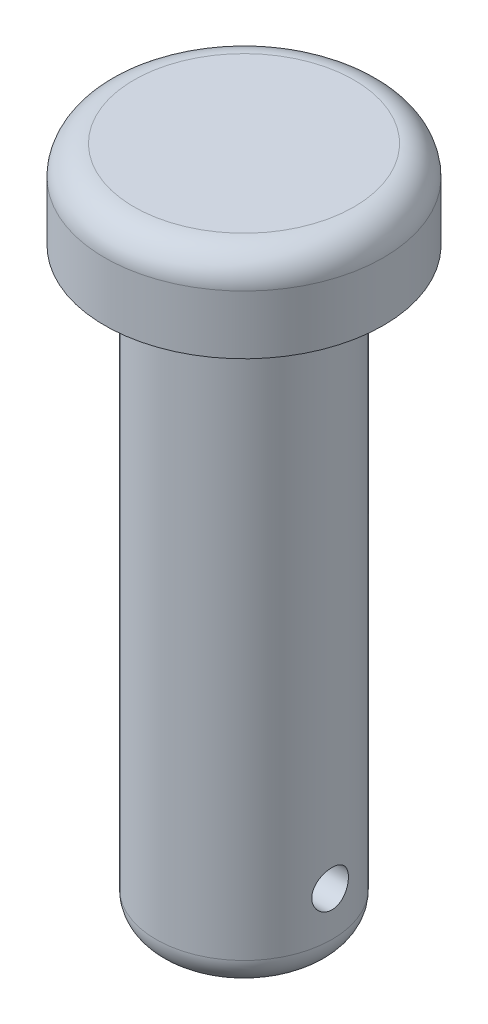
from build123d import *

# Parameters (mm, degrees)
CUT_EXTRUDE1_DEPTH      = 96.843622656
CUT_EXTRUDE1_DEPTH_BACK = 96.843622656
SKETCH2_R               = 2.5


with BuildPart() as part:
    # Sketch1 → Revolve1 (revolve)
    with BuildSketch(Plane.XY):
        with BuildLine():
            Line((0, 0), (8, 0))
            ThreePointArc((8, 0), (10.828427125, 1.171572875), (12, 4))
            Line((12, 4), (12, 80))
            Line((12, 80), (19, 80))
            Line((19, 80), (19, 88))
            ThreePointArc((19, 88), (17.828427125, 90.828427125), (15, 92))
            Line((15, 92), (0, 92))
            Line((0, 92), (0, 0))
        make_face()
    revolve(axis=Axis((0, -790.652262501, 0), (0, 1, 0)))

    # Sketch2 → Cut-Extrude1 (cut, two sides: drawn at the far end of the back side and taken through both)
    with BuildSketch(Plane(origin=(0, 0, 0), x_dir=(0, 0, -1), z_dir=(1, 0, 0)).offset(-CUT_EXTRUDE1_DEPTH_BACK)):
        with Locations((0, 10)):
            Circle(SKETCH2_R)
    extrude(amount=CUT_EXTRUDE1_DEPTH + CUT_EXTRUDE1_DEPTH_BACK, mode=Mode.SUBTRACT)


solid = part.part
